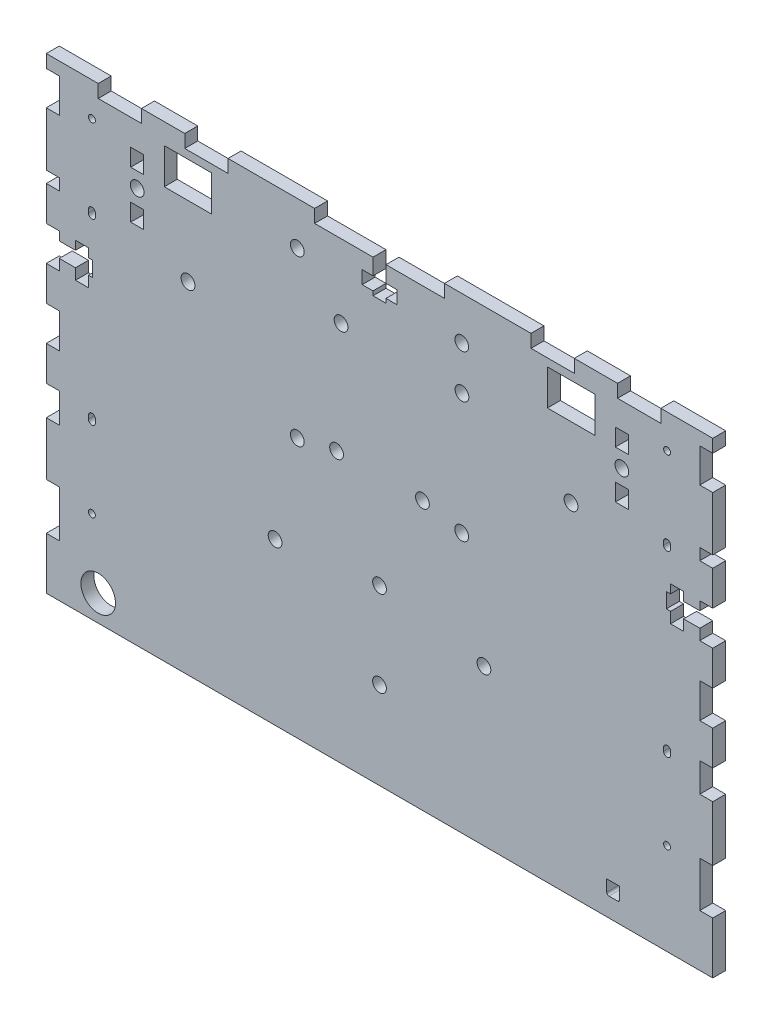
from build123d import *

# Parameters (mm, degrees)
CROQUIS2_R              = 4
CROQUIS2_R_2            = 1.600000002
CROQUIS2_W              = 3
CROQUIS2_H              = 4
SALIENTE_EXTRUIR1_DEPTH = 3


with BuildPart() as part:
    # Croquis2 → Saliente-Extruir1 (new body)
    with BuildSketch(Plane.XY):
        Polygon((33590.333961548, 12966.467187287), (33590.333961548, 12954.467187287), (33744.333961548, 12954.467187287), (33744.333961548, 12966.468137918), (33741.333961548, 12966.468137918), (33741.333961548, 12976.944340211), (33744.333961548, 12976.944340211), (33744.333961548, 12989.744340211), (33741.333961548, 12989.744340211), (33741.333961548, 12996.467187287), (33744.333961548, 12996.467187287), (33744.333961548, 13000.918872602), (33744.333961548, 13001.218871754), (33744.333961548, 13004.467187287), (33741.333961548, 13004.467187287), (33741.333961548, 13012.467187287), (33744.333961548, 13012.467187287), (33744.333961548, 13020.467187287), (33741.333961548, 13020.467187287), (33741.333961548, 13022.965100239), (33737.583961548, 13022.965100239), (33737.583961548, 13020.467187287), (33734.583961548, 13020.467187287), (33734.583961548, 13022.965100239), (33733.603961548, 13022.965100239), (33733.603961548, 13026.459271225), (33734.583961548, 13026.459271225), (33734.583961548, 13028.467187287), (33737.583961548, 13028.467187287), (33737.583961548, 13026.459271225), (33741.333961548, 13026.459271225), (33741.333961548, 13028.467187287), (33744.333961548, 13028.467187287), (33744.333961548, 13036.467187287), (33741.333961548, 13036.467187287), (33741.333961548, 13039.127456833), (33744.333961548, 13039.127456833), (33744.333961548, 13051.608818575), (33741.333961548, 13051.608818575), (33741.333961548, 13059.467187287), (33744.333961548, 13059.467187287), (33744.333961548, 13062.467187287), (33732.333961548, 13062.467187287), (33732.333961548, 13059.467187287), (33722.333961548, 13059.467187287), (33722.333961548, 13062.467187287), (33712.333961548, 13062.467187287), (33712.333961548, 13059.467187287), (33702.333961548, 13059.467187287), (33702.333961548, 13062.467187287), (33682.333961548, 13062.467187287), (33682.333961548, 13059.467187287), (33668.833961548, 13059.467187287), (33668.833961548, 13055.717187287), (33671.333961548, 13055.717187287), (33671.333961548, 13052.717187287), (33668.833961548, 13052.717187287), (33668.833961548, 13051.737187287), (33665.833961548, 13051.737187287), (33665.833961548, 13052.717187287), (33663.333961548, 13052.717187287), (33663.333961548, 13055.717187287), (33665.833961548, 13055.717187287), (33665.833961548, 13059.467187287), (33652.333961548, 13059.467187287), (33652.333961548, 13062.467187287), (33632.333961548, 13062.467187287), (33632.333961548, 13059.467187287), (33622.333961548, 13059.467187287), (33622.333961548, 13062.467187287), (33612.333961548, 13062.467187287), (33612.333961548, 13059.467187287), (33602.333961548, 13059.467187287), (33602.333961548, 13062.467187287), (33590.333961548, 13062.467187287), (33590.333961548, 13059.467187287), (33593.333961548, 13059.467187287), (33593.333961548, 13051.608615304), (33590.333961548, 13051.608615304), (33590.333961548, 13039.127737267), (33593.333961548, 13039.127940926), (33593.333961548, 13036.467187287), (33590.333961548, 13036.467187287), (33590.333961548, 13028.467187287), (33593.333961548, 13028.467187287), (33593.333961548, 13026.459271225), (33597.083961548, 13026.459271225), (33597.083961548, 13028.467187287), (33600.083961548, 13028.467187287), (33600.083961548, 13026.459271225), (33601.063961548, 13026.459271225), (33601.063961548, 13022.965100239), (33600.083961548, 13022.965100239), (33600.083961548, 13020.467187287), (33597.083961548, 13020.467187287), (33597.083961548, 13022.965100239), (33593.333961548, 13022.965100239), (33593.333961548, 13020.467187287), (33590.333961548, 13020.467187287), (33590.333961548, 13012.467187287), (33593.333961548, 13012.467187287), (33593.333961548, 13004.467187287), (33590.333961548, 13004.467187287), (33590.333961548, 12996.467187287), (33593.333961548, 12996.467187287), (33593.333961548, 12989.594741061), (33590.333961548, 12989.594537402), (33590.333961548, 12977.23851785), (33593.333961548, 12977.23872151), (33593.333961548, 12966.467187287), align=None)
        with Locations((33602.333961548, 12960.467187287)):
            Circle(CROQUIS2_R, mode=Mode.SUBTRACT)
        with BuildLine():
            ThreePointArc((33600.087956373, 12975.615115182), (33600.425762465, 12976.325306858), (33601.208339354, 12976.403143772))
            ThreePointArc((33601.208339354, 12976.403143772), (33601.335728821, 12976.332580573), (33601.448216104, 12976.240093535))
            ThreePointArc((33601.448216104, 12976.240093535), (33601.624168032, 12975.979363032), (33601.686005205, 12975.670954796))
            ThreePointArc((33601.686005205, 12975.670954796), (33601.644959695, 12975.41799614), (33601.526035, 12975.190994526))
            ThreePointArc((33601.526035, 12975.190994526), (33601.403734272, 12975.061072338), (33601.255678754, 12974.961489176))
            ThreePointArc((33601.255678754, 12974.961489176), (33600.628203043, 12974.913631849), (33600.160248902, 12975.334387138))
            ThreePointArc((33600.160248902, 12975.334387138), (33600.111281008, 12975.47144936), (33600.087956373, 12975.615115182))
        make_face(mode=Mode.SUBTRACT)
        with BuildLine():
            Line((33600.086005205, 12994.171503394), (33600.086005205, 12994.971503394))
            ThreePointArc((33600.086005205, 12994.971503394), (33600.886005205, 12995.771503394), (33601.686005205, 12994.971503394))
            Line((33601.686005205, 12994.971503394), (33601.686005205, 12994.171503394))
            ThreePointArc((33601.686005205, 12994.171503394), (33601.644959695, 12993.918544738), (33601.526035, 12993.691543124))
            ThreePointArc((33601.526035, 12993.691543124), (33601.403734272, 12993.561620936), (33601.255678754, 12993.462037774))
            ThreePointArc((33601.255678754, 12993.462037774), (33600.628203043, 12993.414180447), (33600.160248902, 12993.834935736))
            ThreePointArc((33600.160248902, 12993.834935736), (33600.111281008, 12993.971997958), (33600.087956373, 12994.11566378))
            ThreePointArc((33600.087956373, 12994.11566378), (33600.086493146, 12994.143566548), (33600.086005205, 12994.171503394))
        make_face(mode=Mode.SUBTRACT)
        with BuildLine():
            ThreePointArc((33641.622691408, 12991.56280403), (33641.622516995, 12991.564780957), (33641.622345053, 12991.566758101))
            ThreePointArc((33641.622345053, 12991.566758101), (33641.616508597, 12991.691084552), (33641.620430045, 12991.815486131))
            ThreePointArc((33641.620430045, 12991.815486131), (33642.10296815, 12992.84697175), (33643.152048274, 12993.289957639))
            ThreePointArc((33643.152048274, 12993.289957639), (33643.27181994, 12993.289355699), (33643.391205332, 12993.279725412))
            ThreePointArc((33643.391205332, 12993.279725412), (33643.675542017, 12993.219145759), (33643.944063538, 12993.107730155))
            ThreePointArc((33643.944063538, 12993.107730155), (33644.068903811, 12993.034483277), (33644.186553772, 12992.950170255))
            ThreePointArc((33644.186553772, 12992.950170255), (33644.609245852, 12992.441772843), (33644.788182771, 12991.805283957))
            ThreePointArc((33644.788182771, 12991.805283957), (33644.791414498, 12991.691084552), (33644.786424769, 12991.576948445))
            ThreePointArc((33644.786424769, 12991.576948445), (33644.630082468, 12991.005929186), (33644.27539381, 12990.531901902))
            ThreePointArc((33644.27539381, 12990.531901902), (33644.163492687, 12990.438610574), (33644.043510249, 12990.355970706))
            ThreePointArc((33644.043510249, 12990.355970706), (33643.729113926, 12990.205184113), (33643.389382313, 12990.126672484))
            ThreePointArc((33643.389382313, 12990.126672484), (33643.27181994, 12990.117257663), (33643.153883035, 12990.116596754))
            ThreePointArc((33643.153883035, 12990.116596754), (33642.225303598, 12990.453352735), (33641.675606099, 12991.274021377))
            ThreePointArc((33641.675606099, 12991.274021377), (33641.642458528, 12991.417186829), (33641.622691408, 12991.56280403))
        make_face(mode=Mode.SUBTRACT)
        with BuildLine():
            ThreePointArc((33665.752691408, 12974.501684636), (33666.454421812, 12975.963764414), (33668.074063538, 12976.046610761))
            ThreePointArc((33668.074063538, 12976.046610761), (33668.198903811, 12975.973363883), (33668.316553772, 12975.889050861))
            ThreePointArc((33668.316553772, 12975.889050861), (33668.76225098, 12975.335112642), (33668.921461548, 12974.642187287))
            ThreePointArc((33668.921461548, 12974.642187287), (33668.786727008, 12974.002164814), (33668.40539381, 12973.470782508))
            ThreePointArc((33668.40539381, 12973.470782508), (33668.293492687, 12973.37749118), (33668.173510249, 12973.294851312))
            ThreePointArc((33668.173510249, 12973.294851312), (33666.760099245, 12973.162039218), (33665.805606099, 12974.212901983))
            ThreePointArc((33665.805606099, 12974.212901983), (33665.772458528, 12974.356067435), (33665.752691408, 12974.501684636))
        make_face(mode=Mode.SUBTRACT)
        with BuildLine():
            Line((33722.833961548, 12962.067187287), (33722.833961548, 12959.367187287))
            ThreePointArc((33722.833961548, 12959.367187287), (33722.687514938, 12959.013633896), (33722.333961548, 12958.867187287))
            Line((33722.333961548, 12958.867187287), (33720.333961548, 12958.867187287))
            ThreePointArc((33720.333961548, 12958.867187287), (33719.980408157, 12959.013633896), (33719.833961548, 12959.367187287))
            Line((33719.833961548, 12959.367187287), (33719.833961548, 12962.067187287))
            Line((33719.833961548, 12962.067187287), (33722.833961548, 12962.067187287))
        make_face(mode=Mode.SUBTRACT)
        with BuildLine():
            ThreePointArc((33732.983869059, 12975.615115182), (33733.321675151, 12976.325306858), (33734.10425204, 12976.403143772))
            ThreePointArc((33734.10425204, 12976.403143772), (33734.231641507, 12976.332580573), (33734.34412879, 12976.240093535))
            ThreePointArc((33734.34412879, 12976.240093535), (33734.520080718, 12975.979363032), (33734.581917891, 12975.670954796))
            ThreePointArc((33734.581917891, 12975.670954796), (33734.540872381, 12975.41799614), (33734.421947686, 12975.190994526))
            ThreePointArc((33734.421947686, 12975.190994526), (33734.299646958, 12975.061072338), (33734.15159144, 12974.961489176))
            ThreePointArc((33734.15159144, 12974.961489176), (33733.524115729, 12974.913631849), (33733.056161588, 12975.334387138))
            ThreePointArc((33733.056161588, 12975.334387138), (33733.007193694, 12975.47144936), (33732.983869059, 12975.615115182))
        make_face(mode=Mode.SUBTRACT)
        with BuildLine():
            ThreePointArc((33665.752691408, 12994.351684636), (33666.454421812, 12995.813764414), (33668.074063538, 12995.896610761))
            ThreePointArc((33668.074063538, 12995.896610761), (33668.198903811, 12995.823363883), (33668.316553772, 12995.739050861))
            ThreePointArc((33668.316553772, 12995.739050861), (33668.76225098, 12995.185112642), (33668.921461548, 12994.492187287))
            ThreePointArc((33668.921461548, 12994.492187287), (33668.786727008, 12993.852164814), (33668.40539381, 12993.320782508))
            ThreePointArc((33668.40539381, 12993.320782508), (33668.293492687, 12993.22749118), (33668.173510249, 12993.144851312))
            ThreePointArc((33668.173510249, 12993.144851312), (33666.760099245, 12993.012039218), (33665.805606099, 12994.062901983))
            ThreePointArc((33665.805606099, 12994.062901983), (33665.772458528, 12994.206067435), (33665.752691408, 12994.351684636))
        make_face(mode=Mode.SUBTRACT)
        with BuildLine():
            ThreePointArc((33691.32117716, 12988.852240943), (33690.320221286, 12989.332391397), (33689.878600107, 12990.350933421))
            ThreePointArc((33689.878600107, 12990.350933421), (33689.876855258, 12990.46866026), (33689.883840623, 12990.58619263))
            ThreePointArc((33689.883840623, 12990.58619263), (33690.346905653, 12991.561288231), (33691.326462048, 12992.01484079))
            ThreePointArc((33691.326462048, 12992.01484079), (33691.442521146, 12992.02066189), (33691.558695126, 12992.017977561))
            ThreePointArc((33691.558695126, 12992.017977561), (33692.564517423, 12991.577392786), (33693.043767984, 12990.589408809))
            ThreePointArc((33693.043767984, 12990.589408809), (33693.04953699, 12990.511452482), (33693.051461548, 12990.433306681))
            ThreePointArc((33693.051461548, 12990.433306681), (33693.050884062, 12990.39049098), (33693.049152024, 12990.347706428))
            ThreePointArc((33693.049152024, 12990.347706428), (33692.591592072, 12989.315896438), (33691.563990737, 12988.848961261))
            ThreePointArc((33691.563990737, 12988.848961261), (33691.442521146, 12988.845951472), (33691.32117716, 12988.852240943))
        make_face(mode=Mode.SUBTRACT)
        with BuildLine():
            Line((33732.981917891, 12994.171503394), (33732.981917891, 12994.971503394))
            ThreePointArc((33732.981917891, 12994.971503394), (33733.781917891, 12995.771503394), (33734.581917891, 12994.971503394))
            Line((33734.581917891, 12994.971503394), (33734.581917891, 12994.171503394))
            ThreePointArc((33734.581917891, 12994.171503394), (33734.540872381, 12993.918544738), (33734.421947686, 12993.691543124))
            ThreePointArc((33734.421947686, 12993.691543124), (33734.299646958, 12993.561620936), (33734.15159144, 12993.462037774))
            ThreePointArc((33734.15159144, 12993.462037774), (33733.524115729, 12993.414180447), (33733.056161588, 12993.834935736))
            ThreePointArc((33733.056161588, 12993.834935736), (33733.007193694, 12993.971997958), (33732.983869059, 12994.11566378))
            ThreePointArc((33732.983869059, 12994.11566378), (33732.982405832, 12994.143566548), (33732.981917891, 12994.171503394))
        make_face(mode=Mode.SUBTRACT)
        with Locations((33623.083961548, 13033.167187287)):
            Circle(CROQUIS2_R_2, mode=Mode.SUBTRACT)
        with BuildLine():
            ThreePointArc((33646.752691408, 13014.376684636), (33647.454421812, 13015.838764414), (33649.074063538, 13015.921610761))
            ThreePointArc((33649.074063538, 13015.921610761), (33649.198903811, 13015.848363883), (33649.316553772, 13015.764050861))
            ThreePointArc((33649.316553772, 13015.764050861), (33649.76225098, 13015.210112642), (33649.921461548, 13014.517187287))
            ThreePointArc((33649.921461548, 13014.517187287), (33649.786727008, 13013.877164814), (33649.40539381, 13013.345782508))
            ThreePointArc((33649.40539381, 13013.345782508), (33649.293492687, 13013.25249118), (33649.173510249, 13013.169851312))
            ThreePointArc((33649.173510249, 13013.169851312), (33647.760099245, 13013.037039218), (33646.805606099, 13014.087901983))
            ThreePointArc((33646.805606099, 13014.087901983), (33646.772458528, 13014.231067435), (33646.752691408, 13014.376684636))
        make_face(mode=Mode.SUBTRACT)
        with BuildLine():
            ThreePointArc((33655.827691408, 13016.326684636), (33656.529421812, 13017.788764414), (33658.149063538, 13017.871610761))
            ThreePointArc((33658.149063538, 13017.871610761), (33658.273903811, 13017.798363883), (33658.391553772, 13017.714050861))
            ThreePointArc((33658.391553772, 13017.714050861), (33658.83725098, 13017.160112642), (33658.996461548, 13016.467187287))
            ThreePointArc((33658.996461548, 13016.467187287), (33658.861727008, 13015.827164814), (33658.48039381, 13015.295782508))
            ThreePointArc((33658.48039381, 13015.295782508), (33658.368492687, 13015.20249118), (33658.248510249, 13015.119851312))
            ThreePointArc((33658.248510249, 13015.119851312), (33656.835099245, 13014.987039218), (33655.880606099, 13016.037901983))
            ThreePointArc((33655.880606099, 13016.037901983), (33655.847458528, 13016.181067435), (33655.827691408, 13016.326684636))
        make_face(mode=Mode.SUBTRACT)
        with BuildLine():
            Line((33600.086005205, 13035.408908395), (33600.086005205, 13036.208908395))
            ThreePointArc((33600.086005205, 13036.208908395), (33600.886005205, 13037.008908395), (33601.686005205, 13036.208908395))
            Line((33601.686005205, 13036.208908395), (33601.686005205, 13035.408908395))
            ThreePointArc((33601.686005205, 13035.408908395), (33601.644959695, 13035.155949739), (33601.526035, 13034.928948125))
            ThreePointArc((33601.526035, 13034.928948125), (33601.403734272, 13034.799025937), (33601.255678754, 13034.699442775))
            ThreePointArc((33601.255678754, 13034.699442775), (33600.628203043, 13034.651585448), (33600.160248902, 13035.072340737))
            ThreePointArc((33600.160248902, 13035.072340737), (33600.104786592, 13035.236578831), (33600.086005205, 13035.408908395))
        make_face(mode=Mode.SUBTRACT)
        with Locations((33611.333961548, 13040.467187287)):
            Rectangle(CROQUIS2_W, CROQUIS2_H, mode=Mode.SUBTRACT)
        with BuildLine():
            ThreePointArc((33609.752691408, 13045.826684636), (33610.454421812, 13047.288764414), (33612.074063538, 13047.371610761))
            ThreePointArc((33612.074063538, 13047.371610761), (33612.198903811, 13047.298363883), (33612.316553772, 13047.214050861))
            ThreePointArc((33612.316553772, 13047.214050861), (33612.76225098, 13046.660112642), (33612.921461548, 13045.967187287))
            ThreePointArc((33612.921461548, 13045.967187287), (33612.786727008, 13045.327164814), (33612.40539381, 13044.795782508))
            ThreePointArc((33612.40539381, 13044.795782508), (33612.293492687, 13044.70249118), (33612.173510249, 13044.619851312))
            ThreePointArc((33612.173510249, 13044.619851312), (33610.760099245, 13044.487039218), (33609.805606099, 13045.537901983))
            ThreePointArc((33609.805606099, 13045.537901983), (33609.772458528, 13045.681067435), (33609.752691408, 13045.826684636))
        make_face(mode=Mode.SUBTRACT)
        with BuildLine():
            ThreePointArc((33600.087956373, 13054.627865761), (33600.425762465, 13055.338057437), (33601.208339354, 13055.415894351))
            ThreePointArc((33601.208339354, 13055.415894351), (33601.335728821, 13055.345331152), (33601.448216104, 13055.252844114))
            ThreePointArc((33601.448216104, 13055.252844114), (33601.624168032, 13054.992113611), (33601.686005205, 13054.683705375))
            ThreePointArc((33601.686005205, 13054.683705375), (33601.644959695, 13054.430746719), (33601.526035, 13054.203745105))
            ThreePointArc((33601.526035, 13054.203745105), (33601.403734272, 13054.073822917), (33601.255678754, 13053.974239755))
            ThreePointArc((33601.255678754, 13053.974239755), (33600.628203043, 13053.926382428), (33600.160248902, 13054.347137717))
            ThreePointArc((33600.160248902, 13054.347137717), (33600.111281008, 13054.484199939), (33600.087956373, 13054.627865761))
        make_face(mode=Mode.SUBTRACT)
        with Locations((33611.333961548, 13051.467187287)):
            Rectangle(CROQUIS2_W, CROQUIS2_H, mode=Mode.SUBTRACT)
        Polygon((33617.597283647, 13052.426458538), (33617.597283647, 13057.670438664), (33628.536349603, 13057.670438664), (33628.536349603, 13052.426458538), (33628.536349603, 13049.426458538), (33617.597283647, 13049.426458538), align=None, mode=Mode.SUBTRACT)
        with BuildLine():
            ThreePointArc((33658.301496182, 13040.922212165), (33657.282413384, 13041.421196652), (33656.856750536, 13042.473017172))
            ThreePointArc((33656.856750536, 13042.473017172), (33656.858888587, 13042.591056095), (33656.869792906, 13042.708609718))
            ThreePointArc((33656.869792906, 13042.708609718), (33657.348760036, 13043.652519411), (33658.31461619, 13044.085528546))
            ThreePointArc((33658.31461619, 13044.085528546), (33658.445676136, 13044.090805755), (33658.576724377, 13044.085245454))
            ThreePointArc((33658.576724377, 13044.085245454), (33659.539465302, 13043.652231298), (33660.017792613, 13042.711181707))
            ThreePointArc((33660.017792613, 13042.711181707), (33660.028040628, 13042.607468654), (33660.031461548, 13042.503306681))
            ThreePointArc((33660.031461548, 13042.503306681), (33660.031376395, 13042.486864277), (33660.031120946, 13042.470423637))
            ThreePointArc((33660.031120946, 13042.470423637), (33659.592830117, 13041.40774415), (33658.552156215, 13040.919497929))
            ThreePointArc((33658.552156215, 13040.919497929), (33658.42677254, 13040.915899743), (33658.301496182, 13040.922212165))
        make_face(mode=Mode.SUBTRACT)
        with BuildLine():
            ThreePointArc((33646.752691408, 13052.376684636), (33647.454421812, 13053.838764414), (33649.074063538, 13053.921610761))
            ThreePointArc((33649.074063538, 13053.921610761), (33649.198903811, 13053.848363883), (33649.316553772, 13053.764050861))
            ThreePointArc((33649.316553772, 13053.764050861), (33649.76225098, 13053.210112642), (33649.921461548, 13052.517187287))
            ThreePointArc((33649.921461548, 13052.517187287), (33649.786727008, 13051.877164814), (33649.40539381, 13051.345782508))
            ThreePointArc((33649.40539381, 13051.345782508), (33649.293492687, 13051.25249118), (33649.173510249, 13051.169851312))
            ThreePointArc((33649.173510249, 13051.169851312), (33647.760099245, 13051.037039218), (33646.805606099, 13052.087901983))
            ThreePointArc((33646.805606099, 13052.087901983), (33646.772458528, 13052.231067435), (33646.752691408, 13052.376684636))
        make_face(mode=Mode.SUBTRACT)
        with BuildLine():
            ThreePointArc((33684.752691408, 13014.376684636), (33685.454421812, 13015.838764414), (33687.074063538, 13015.921610761))
            ThreePointArc((33687.074063538, 13015.921610761), (33687.198903811, 13015.848363883), (33687.316553772, 13015.764050861))
            ThreePointArc((33687.316553772, 13015.764050861), (33687.76225098, 13015.210112642), (33687.921461548, 13014.517187287))
            ThreePointArc((33687.921461548, 13014.517187287), (33687.786727008, 13013.877164814), (33687.40539381, 13013.345782508))
            ThreePointArc((33687.40539381, 13013.345782508), (33687.293492687, 13013.25249118), (33687.173510249, 13013.169851312))
            ThreePointArc((33687.173510249, 13013.169851312), (33685.760099245, 13013.037039218), (33684.805606099, 13014.087901983))
            ThreePointArc((33684.805606099, 13014.087901983), (33684.772458528, 13014.231067435), (33684.752691408, 13014.376684636))
        make_face(mode=Mode.SUBTRACT)
        with BuildLine():
            ThreePointArc((33675.677691408, 13016.326684636), (33676.379421812, 13017.788764414), (33677.999063538, 13017.871610761))
            ThreePointArc((33677.999063538, 13017.871610761), (33678.123903811, 13017.798363883), (33678.241553772, 13017.714050861))
            ThreePointArc((33678.241553772, 13017.714050861), (33678.68725098, 13017.160112642), (33678.846461548, 13016.467187287))
            ThreePointArc((33678.846461548, 13016.467187287), (33678.711727008, 13015.827164814), (33678.33039381, 13015.295782508))
            ThreePointArc((33678.33039381, 13015.295782508), (33678.218492687, 13015.20249118), (33678.098510249, 13015.119851312))
            ThreePointArc((33678.098510249, 13015.119851312), (33676.685099245, 13014.987039218), (33675.730606099, 13016.037901983))
            ThreePointArc((33675.730606099, 13016.037901983), (33675.697458528, 13016.181067435), (33675.677691408, 13016.326684636))
        make_face(mode=Mode.SUBTRACT)
        with Locations((33711.583961548, 13033.167187287)):
            Circle(CROQUIS2_R_2, mode=Mode.SUBTRACT)
        with BuildLine():
            ThreePointArc((33686.173191416, 13040.929860717), (33685.191070018, 13041.455849737), (33684.796471336, 13042.497732057))
            ThreePointArc((33684.796471336, 13042.497732057), (33684.800095467, 13042.610658846), (33684.811742509, 13042.723041853))
            ThreePointArc((33684.811742509, 13042.723041853), (33685.270367404, 13043.634705962), (33686.18919112, 13044.078813181))
            ThreePointArc((33686.18919112, 13044.078813181), (33686.299556751, 13044.08856126), (33686.410333515, 13044.090587617))
            ThreePointArc((33686.410333515, 13044.090587617), (33687.431043643, 13043.696527254), (33687.954365463, 13042.735659414))
            ThreePointArc((33687.954365463, 13042.735659414), (33687.967181757, 13042.619797097), (33687.971461548, 13042.503306681))
            ThreePointArc((33687.971461548, 13042.503306681), (33687.971435115, 13042.494145671), (33687.971355816, 13042.484984967))
            ThreePointArc((33687.971355816, 13042.484984967), (33687.51501089, 13041.389357116), (33686.426461561, 13040.916375681))
            ThreePointArc((33686.426461561, 13040.916375681), (33686.299556751, 13040.918052102), (33686.173191416, 13040.929860717))
        make_face(mode=Mode.SUBTRACT)
        with BuildLine():
            ThreePointArc((33684.752691408, 13052.376684636), (33685.454421812, 13053.838764414), (33687.074063538, 13053.921610761))
            ThreePointArc((33687.074063538, 13053.921610761), (33687.198903811, 13053.848363883), (33687.316553772, 13053.764050861))
            ThreePointArc((33687.316553772, 13053.764050861), (33687.76225098, 13053.210112642), (33687.921461548, 13052.517187287))
            ThreePointArc((33687.921461548, 13052.517187287), (33687.786727008, 13051.877164814), (33687.40539381, 13051.345782508))
            ThreePointArc((33687.40539381, 13051.345782508), (33687.293492687, 13051.25249118), (33687.173510249, 13051.169851312))
            ThreePointArc((33687.173510249, 13051.169851312), (33685.760099245, 13051.037039218), (33684.805606099, 13052.087901983))
            ThreePointArc((33684.805606099, 13052.087901983), (33684.772458528, 13052.231067435), (33684.752691408, 13052.376684636))
        make_face(mode=Mode.SUBTRACT)
        with Locations((33723.333961548, 13040.467187287)):
            Rectangle(CROQUIS2_W, CROQUIS2_H, mode=Mode.SUBTRACT)
        with BuildLine():
            ThreePointArc((33721.752691408, 13045.826684636), (33722.454421812, 13047.288764414), (33724.074063538, 13047.371610761))
            ThreePointArc((33724.074063538, 13047.371610761), (33724.198903811, 13047.298363883), (33724.316553772, 13047.214050861))
            ThreePointArc((33724.316553772, 13047.214050861), (33724.76225098, 13046.660112642), (33724.921461548, 13045.967187287))
            ThreePointArc((33724.921461548, 13045.967187287), (33724.786727008, 13045.327164814), (33724.40539381, 13044.795782508))
            ThreePointArc((33724.40539381, 13044.795782508), (33724.293492687, 13044.70249118), (33724.173510249, 13044.619851312))
            ThreePointArc((33724.173510249, 13044.619851312), (33722.760099245, 13044.487039218), (33721.805606099, 13045.537901983))
            ThreePointArc((33721.805606099, 13045.537901983), (33721.772458528, 13045.681067435), (33721.752691408, 13045.826684636))
        make_face(mode=Mode.SUBTRACT)
        with BuildLine():
            Line((33732.981917891, 13035.408908395), (33732.981917891, 13036.208908395))
            ThreePointArc((33732.981917891, 13036.208908395), (33733.344806531, 13036.878933514), (33734.10425204, 13036.941097371))
            ThreePointArc((33734.10425204, 13036.941097371), (33734.231641507, 13036.870534172), (33734.34412879, 13036.778047134))
            ThreePointArc((33734.34412879, 13036.778047134), (33734.520080718, 13036.517316631), (33734.581917891, 13036.208908395))
            Line((33734.581917891, 13036.208908395), (33734.581917891, 13035.408908395))
            ThreePointArc((33734.581917891, 13035.408908395), (33734.540872381, 13035.155949739), (33734.421947686, 13034.928948125))
            ThreePointArc((33734.421947686, 13034.928948125), (33734.299646958, 13034.799025937), (33734.15159144, 13034.699442775))
            ThreePointArc((33734.15159144, 13034.699442775), (33733.524115729, 13034.651585448), (33733.056161588, 13035.072340737))
            ThreePointArc((33733.056161588, 13035.072340737), (33733.007193694, 13035.209402959), (33732.983869059, 13035.353068781))
            ThreePointArc((33732.983869059, 13035.353068781), (33732.982405832, 13035.380971549), (33732.981917891, 13035.408908395))
        make_face(mode=Mode.SUBTRACT)
        Polygon((33706.131573493, 13057.670438664), (33717.070639449, 13057.670438664), (33717.070639449, 13052.426458538), (33717.070639449, 13049.426458538), (33706.131573493, 13049.426458538), (33706.131573493, 13052.426458538), align=None, mode=Mode.SUBTRACT)
        with Locations((33723.333961548, 13051.467187287)):
            Rectangle(CROQUIS2_W, CROQUIS2_H, mode=Mode.SUBTRACT)
        with BuildLine():
            ThreePointArc((33732.983869059, 13054.627865761), (33733.321675151, 13055.338057437), (33734.10425204, 13055.415894351))
            ThreePointArc((33734.10425204, 13055.415894351), (33734.231641507, 13055.345331152), (33734.34412879, 13055.252844114))
            ThreePointArc((33734.34412879, 13055.252844114), (33734.520080718, 13054.992113611), (33734.581917891, 13054.683705375))
            ThreePointArc((33734.581917891, 13054.683705375), (33734.540872381, 13054.430746719), (33734.421947686, 13054.203745105))
            ThreePointArc((33734.421947686, 13054.203745105), (33734.299646958, 13054.073822917), (33734.15159144, 13053.974239755))
            ThreePointArc((33734.15159144, 13053.974239755), (33733.524115729, 13053.926382428), (33733.056161588, 13054.347137717))
            ThreePointArc((33733.056161588, 13054.347137717), (33733.007193694, 13054.484199939), (33732.983869059, 13054.627865761))
        make_face(mode=Mode.SUBTRACT)
    extrude(amount=SALIENTE_EXTRUIR1_DEPTH)


solid = part.part
